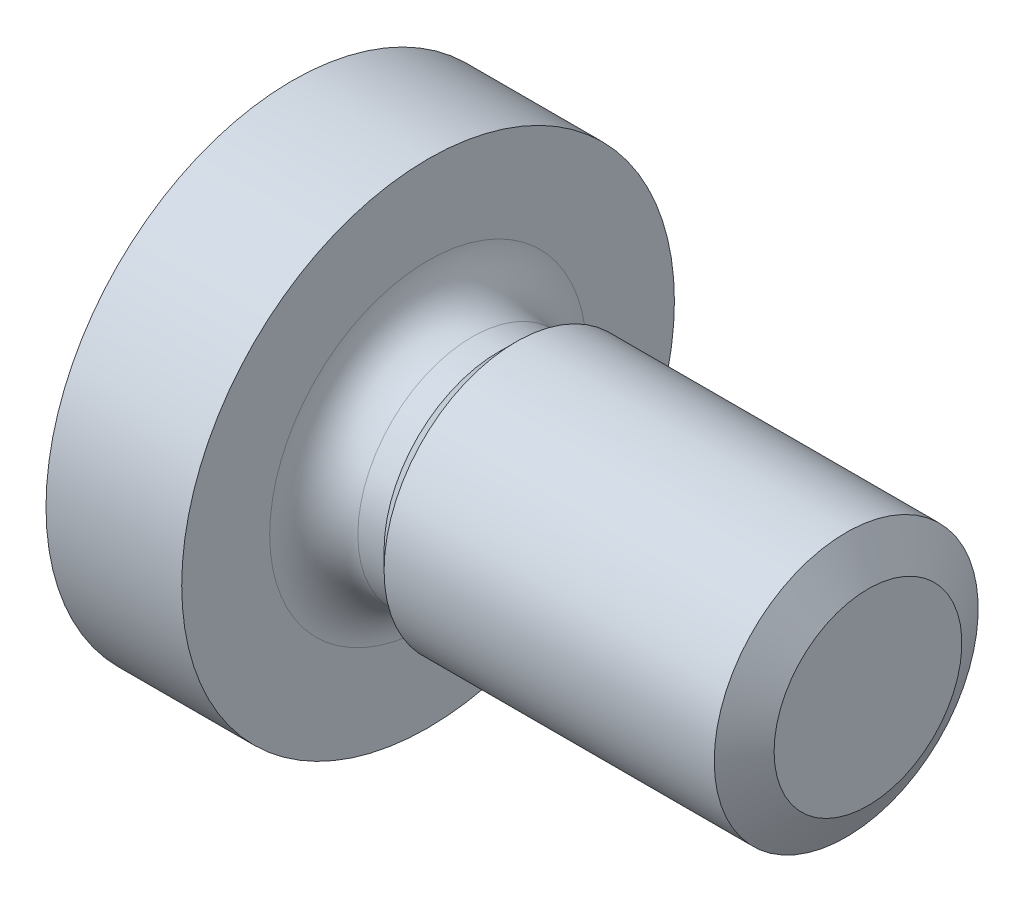
from build123d import *


with BuildPart() as part:
    # 草图2 → Revolve 709 (revolve)
    with BuildSketch(Plane.XY, mode=Mode.PRIVATE) as revolve_709_sk:
        with BuildLine():
            Line((0, 0), (7.4, 0))
            Line((7.4, 0), (7.4, 1.5))
            Line((7.4, 1.5), (3.4, 1.5))
            Line((3.4, 1.5), (3.199, 1.299))
            Line((3.199, 1.299), (2.901, 1.299))
            ThreePointArc((2.901, 1.299), (2.546739503, 1.445739503), (2.4, 1.8))
            Line((2.4, 1.8), (2.4, 2.8))
            Line((2.4, 2.8), (0.857536965, 2.8))
            ThreePointArc((0.857536965, 2.8), (0.219188606, 1.464186604), (0, 0))
        make_face()
    revolve(revolve_709_sk.sketch.rotate(Axis((-1.331757704, 0, 0), (1, 0, 0)), 90), axis=Axis((-1.331757704, 0, 0), (1, 0, 0)))

    # 草图3 → 切除-旋转1 (revolve, cut)
    with BuildSketch(Plane.XY, mode=Mode.PRIVATE) as cut_revolve_1_sk:
        Polygon((7.152708003, 1.5), (7.652708003, 1.5), (7.4, 1.067), align=None)
    revolve(cut_revolve_1_sk.sketch.rotate(Axis((-0.242766179, 0, 0), (1, 0, 0)), 90), axis=Axis((-0.242766179, 0, 0), (1, 0, 0)), mode=Mode.SUBTRACT)

    # 草图5 → 切除-放样1 section 0
    with BuildSketch(Plane(origin=(0, 0, 0), x_dir=(0, 0, -1), z_dir=(1, 0, 0)), mode=Mode.PRIVATE) as loft_1_s0:
        with BuildLine():
            Line((0.25, 1.5), (-0.25, 1.5))
            Line((-0.25, 1.5), (-0.25, -1.5))
            Line((-0.25, -1.5), (0.25, -1.5))
            Line((0.25, -1.5), (0.25, 1.5))
        make_face()
    loft_1 = loft([Vertex(1.8, 0, 0), loft_1_s0.sketch], mode=Mode.SUBTRACT)

    # 镜向1: 切除-放样1 across plane
    add(loft_1.mirror(Plane(origin=(0, 0, 0), x_dir=(0, 0.7071067811865462, 0.7071067811865488), z_dir=(0, -0.7071067811865488, 0.7071067811865462))), mode=Mode.SUBTRACT)


solid = part.part
